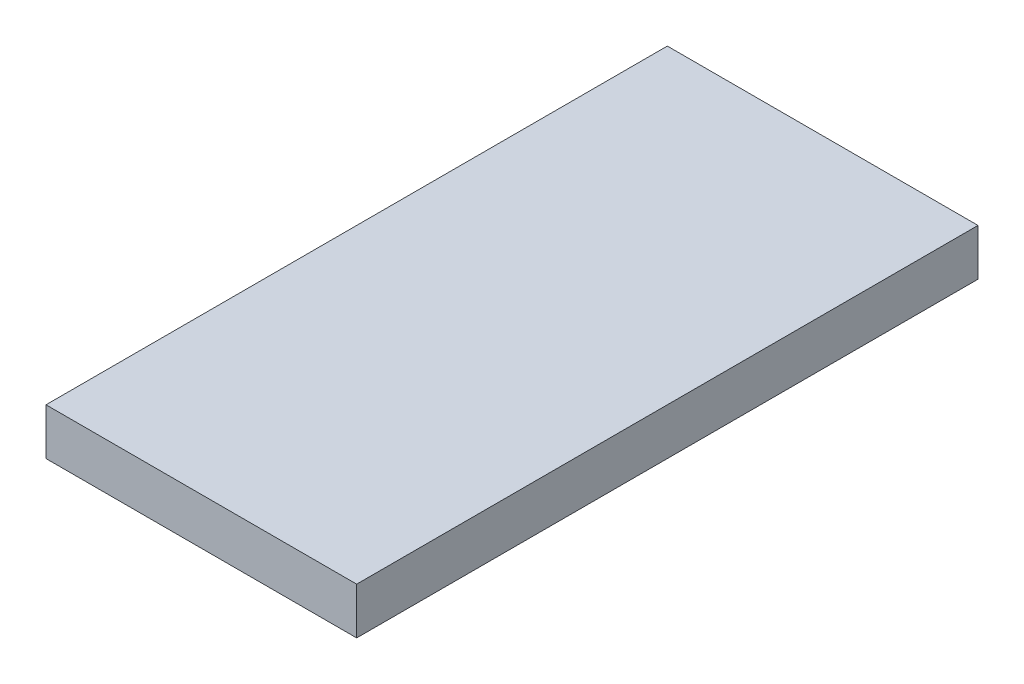
from build123d import *

# Parameters (mm, degrees)
TEPSI_KULP_40X6X80_1_START = 160
SKETCH1_W                  = 40
SKETCH1_H                  = 6
TEPSI_KULP_40X6X80_1_DEPTH = 80


with BuildPart() as part:
    # Sketch1 → TEPSI_kulp_40x6x80_1 (new body)
    with BuildSketch(Plane.XY.offset(TEPSI_KULP_40X6X80_1_START)):
        with Locations((0, 3)):
            Rectangle(SKETCH1_W, SKETCH1_H)
    extrude(amount=TEPSI_KULP_40X6X80_1_DEPTH)


solid = part.part
